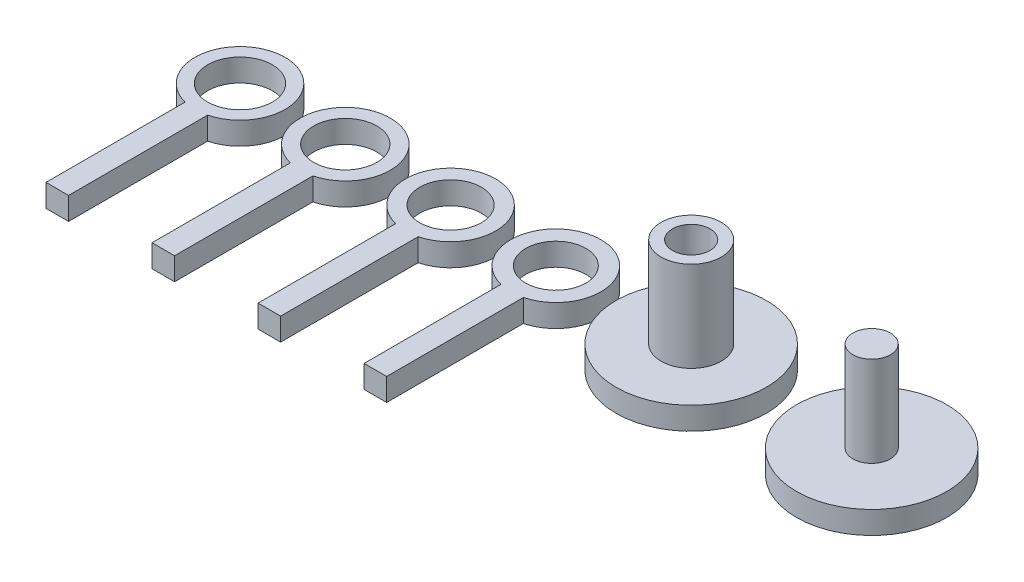
from build123d import *

# Parameters (mm, degrees)
SKETCH_1_R        = 10
EXTRUDE_1_DEPTH   = 3
EXTRUDE_1_2_DEPTH = 3
SKETCH_4_R        = 2.5
EXTRUDE_2_DEPTH   = 12
SKETCH_3_R        = 4
SKETCH_3_R_2      = 2.5
EXTRUDE_3_DEPTH   = 12
SKETCH_5_R        = 4.3
EXTRUDE_4_DEPTH   = 3
SKETCH_5_R_2      = 4.2
EXTRUDE_4_2_DEPTH = 3
SKETCH_5_R_3      = 4.1
EXTRUDE_4_3_DEPTH = 3
SKETCH_5_R_4      = 4
EXTRUDE_4_4_DEPTH = 3


with BuildPart() as part:
    # Эскиз1 → Бобышка-Вытянуть1 (new body)
    with BuildSketch(Plane(origin=(0, 0, 0), x_dir=(1, 0, 0), z_dir=(0, 1, 0))):
        with Locations(Location((0, 0, 0), (0, 0, 270))):
            Circle(SKETCH_1_R)
    extrude(amount=EXTRUDE_1_DEPTH)

    # Эскиз3 → Бобышка-Вытянуть3 (add)
    with BuildSketch(Plane(origin=(0, 3, 0), x_dir=(1, 0, 0), z_dir=(0, 1, 0))):
        with Locations(Location((0, 0, 0), (0, 0, 270))):
            Circle(SKETCH_3_R)
        with Locations(Location((0, 0, 0), (0, 0, 270))):
            Circle(SKETCH_3_R_2, mode=Mode.SUBTRACT)
    extrude(amount=EXTRUDE_3_DEPTH)


with BuildPart() as body_2:
    # Эскиз1 → Extrude 1 2 (new body)
    with BuildSketch(Plane(origin=(0, 0, 0), x_dir=(1, 0, 0), z_dir=(0, 1, 0))):
        with Locations(Location((24, 0, 0), (0, 0, 270))):
            Circle(SKETCH_1_R)
    extrude(amount=EXTRUDE_1_2_DEPTH)

    # Эскиз4 → Бобышка-Вытянуть2 (add)
    with BuildSketch(Plane(origin=(0, 3, 0), x_dir=(1, 0, 0), z_dir=(0, 1, 0))):
        with Locations(Location((24, 0, 0), (0, 0, 270))):
            Circle(SKETCH_4_R)
    extrude(amount=EXTRUDE_2_DEPTH)


with BuildPart() as body_3:
    # Эскиз5 → Бобышка-Вытянуть4 (new body)
    with BuildSketch(Plane(origin=(0, 0, 0), x_dir=(1, 0, 0), z_dir=(0, 1, 0))):
        with BuildLine():
            Line((-61.5, -24.3), (-58.5, -24.3))
            Line((-58.5, -24.3), (-58.5, -5.809475019))
            ThreePointArc((-58.5, -5.809475019), (-60, 6), (-61.5, -5.809475019))
            Line((-61.5, -5.809475019), (-61.5, -24.3))
        make_face()
        with Locations(Location((-60, 0, 0), (0, 0, 270))):
            Circle(SKETCH_5_R, mode=Mode.SUBTRACT)
    extrude(amount=EXTRUDE_4_DEPTH)


with BuildPart() as body_4:
    # Эскиз5 → Extrude 4 2 (new body)
    with BuildSketch(Plane(origin=(0, 0, 0), x_dir=(1, 0, 0), z_dir=(0, 1, 0))):
        with BuildLine():
            Line((-47.5, -24.2), (-44.5, -24.2))
            Line((-44.5, -24.2), (-44.5, -5.809475019))
            ThreePointArc((-44.5, -5.809475019), (-46, 6), (-47.5, -5.809475019))
            Line((-47.5, -5.809475019), (-47.5, -24.2))
        make_face()
        with Locations(Location((-46, 0, 0), (0, 0, 270))):
            Circle(SKETCH_5_R_2, mode=Mode.SUBTRACT)
    extrude(amount=EXTRUDE_4_2_DEPTH)


with BuildPart() as body_5:
    # Эскиз5 → Extrude 4 3 (new body)
    with BuildSketch(Plane(origin=(0, 0, 0), x_dir=(1, 0, 0), z_dir=(0, 1, 0))):
        with BuildLine():
            Line((-33.5, -24.1), (-30.5, -24.1))
            Line((-30.5, -24.1), (-30.5, -5.809475019))
            ThreePointArc((-30.5, -5.809475019), (-32, 6), (-33.5, -5.809475019))
            Line((-33.5, -5.809475019), (-33.5, -24.1))
        make_face()
        with Locations(Location((-32, 0, 0), (0, 0, 270))):
            Circle(SKETCH_5_R_3, mode=Mode.SUBTRACT)
    extrude(amount=EXTRUDE_4_3_DEPTH)


with BuildPart() as body_6:
    # Эскиз5 → Extrude 4 4 (new body)
    with BuildSketch(Plane(origin=(0, 0, 0), x_dir=(1, 0, 0), z_dir=(0, 1, 0))):
        with BuildLine():
            Line((-19.5, -24), (-16.5, -24))
            Line((-16.5, -24), (-16.5, -5.809475019))
            ThreePointArc((-16.5, -5.809475019), (-18, 6), (-19.5, -5.809475019))
            Line((-19.5, -5.809475019), (-19.5, -24))
        make_face()
        with Locations(Location((-18, 0, 0), (0, 0, 270))):
            Circle(SKETCH_5_R_4, mode=Mode.SUBTRACT)
    extrude(amount=EXTRUDE_4_4_DEPTH)


solid = Compound([part.part, body_2.part, body_3.part, body_4.part, body_5.part, body_6.part])
